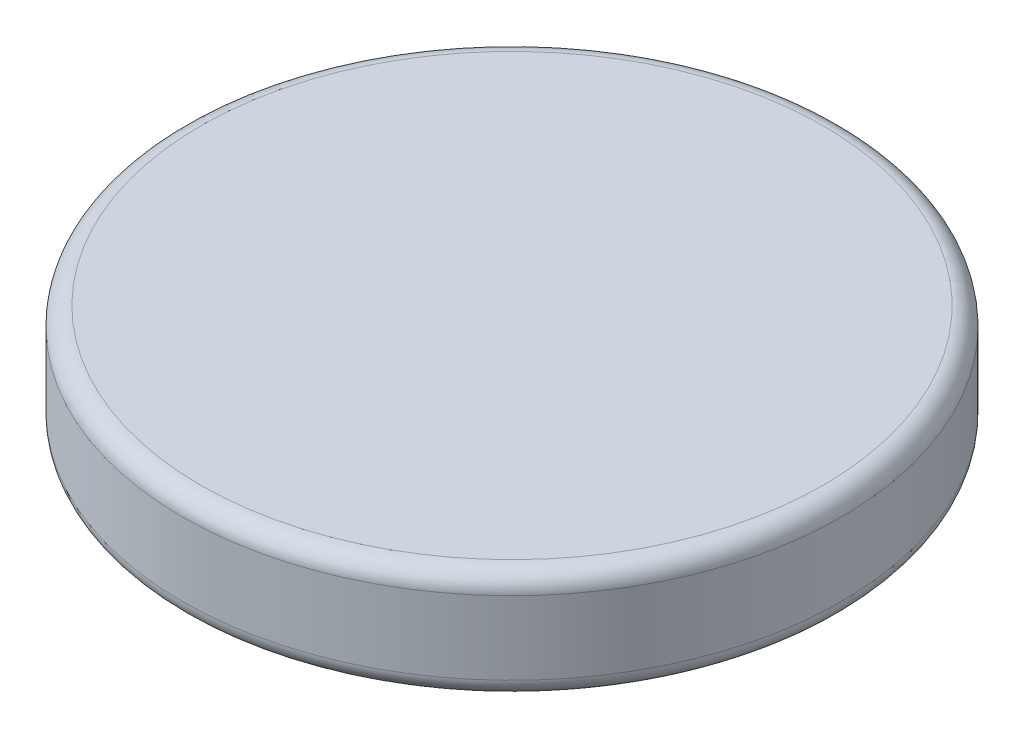
from build123d import *

# Parameters (mm, degrees)
SKETCH1_R           = 9
BOSS_EXTRUDE1_DEPTH = 3
FILLET1_R           = 0.5


with BuildPart() as part:
    # Sketch1 → Boss-Extrude1 (new body)
    with BuildSketch(Plane(origin=(0, 0, 0), x_dir=(1, 0, 0), z_dir=(0, 1, 0))):
        with Locations(Location((0, 0, 0), (0, 0, 270))):
            Circle(SKETCH1_R)
    extrude(amount=BOSS_EXTRUDE1_DEPTH)

    # Fillet1
    fillet1_edges = [part.edges().sort_by_distance(p)[0] for p in [
        (0, 0, -9),
        (0, 3, -9),
    ]]
    fillet(fillet1_edges, radius=FILLET1_R)


solid = part.part
